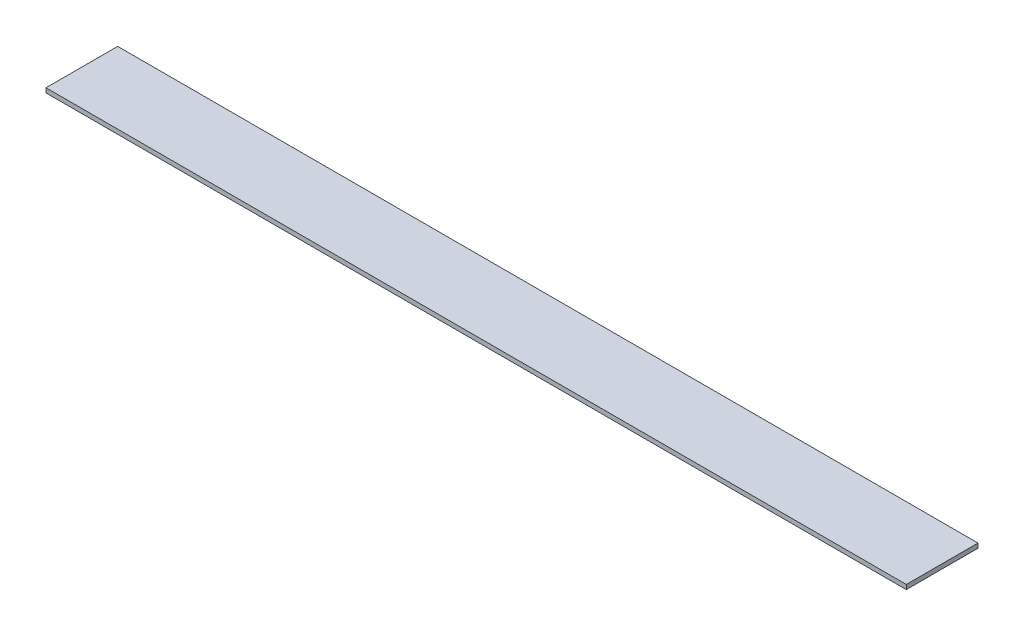
from build123d import *

# Parameters (mm, degrees)
SKETCH1_W           = 304.8
SKETCH1_H           = 25.4
BOSS_EXTRUDE1_DEPTH = 1.5875


with BuildPart() as part:
    # Sketch1 → Boss-Extrude1 (new body)
    with BuildSketch(Plane(origin=(0, 0, 0), x_dir=(1, 0, 0), z_dir=(0, 1, 0))):
        with Locations((152.4, 12.7)):
            Rectangle(SKETCH1_W, SKETCH1_H)
    extrude(amount=BOSS_EXTRUDE1_DEPTH)


solid = part.part
